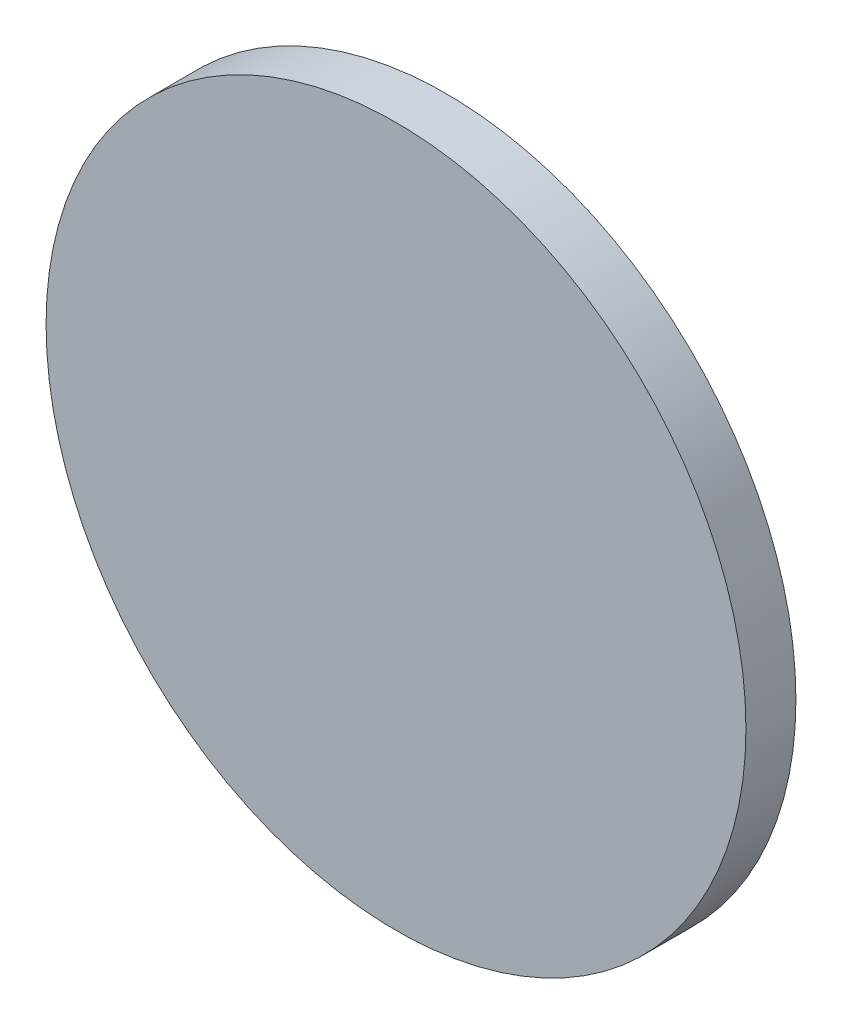
from build123d import *

# Parameters (mm, degrees)
SKETCH2_R           = 70
BOSS_EXTRUDE1_DEPTH = 10
SKETCH1_W           = 89.621
SKETCH1_H           = 71.497
CUT_EXTRUDE1_DEPTH  = 5


with BuildPart() as part:
    # Sketch2 → Boss-Extrude1 (new body)
    with BuildSketch(Plane.XY):
        Circle(SKETCH2_R)
    extrude(amount=BOSS_EXTRUDE1_DEPTH)

    # Sketch1 → Cut-Extrude1 (cut)
    with BuildSketch(Plane.XY):
        Rectangle(SKETCH1_W, SKETCH1_H)
    extrude(amount=CUT_EXTRUDE1_DEPTH, mode=Mode.SUBTRACT)


solid = part.part
